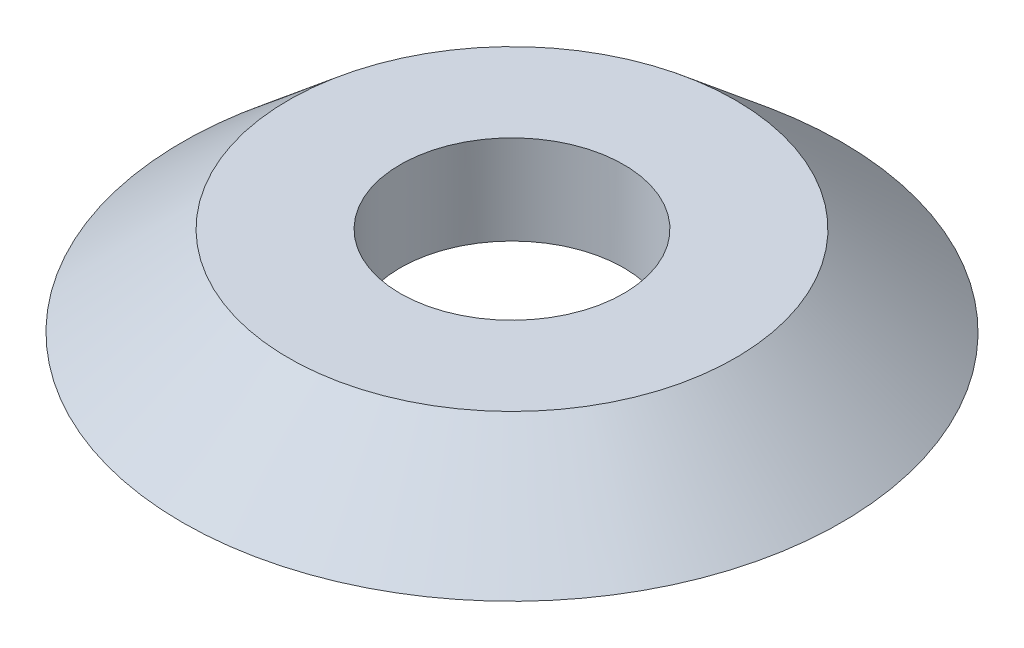
from build123d import *

# Parameters (mm, degrees)
SKETCH3_R          = 2.5
CUT_EXTRUDE1_DEPTH = 10


with BuildPart() as part:
    # Sketch2 → Revolve4 (revolve)
    with BuildSketch(Plane.XY, mode=Mode.PRIVATE) as revolve4_sk:
        Polygon((0, 0), (-7.375, 0), (-5, 2), (0, 2), align=None)
    revolve(revolve4_sk.sketch.rotate(Axis((0, 0, 0), (0, 1, 0)), 270), axis=Axis((0, 0, 0), (0, 1, 0)))

    # Sketch3 → Cut-Extrude1 (cut)
    with BuildSketch(Plane(origin=(0, 2, 0), x_dir=(1, 0, 0), z_dir=(0, 1, 0))):
        with Locations(Location((0, 0, 0), (0, 0, 270))):
            Circle(SKETCH3_R)
    extrude(amount=-CUT_EXTRUDE1_DEPTH, mode=Mode.SUBTRACT)


solid = part.part
